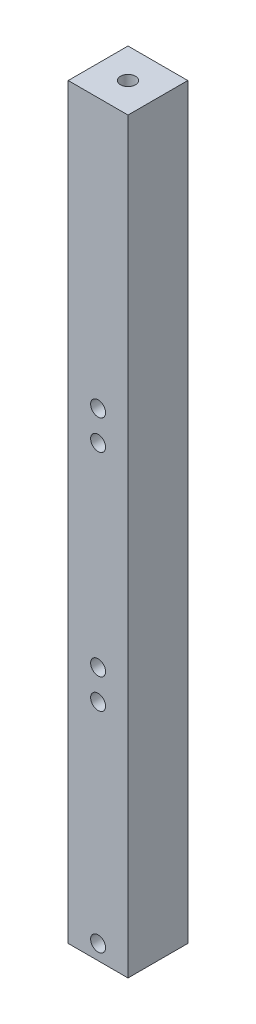
from build123d import *

# Parameters (mm, degrees)
SKETCH2_W           = 20
SKETCH2_H           = 20
SKETCH2_R           = 2.5
BOSS_EXTRUDE1_DEPTH = 250
SKETCH3_R           = 2.5
CUT_EXTRUDE1_DEPTH  = 251.99800796
SKETCH4_R           = 2.5
CUT_EXTRUDE2_DEPTH  = 251.99800796


with BuildPart() as part:
    # Sketch2 → Boss-Extrude1 (new body)
    with BuildSketch(Plane(origin=(0, 0, 0), x_dir=(1, 0, 0), z_dir=(0, 1, 0))):
        Rectangle(SKETCH2_W, SKETCH2_H)
        with Locations(Location((0, 0, 0), (0, 0, 270))):
            Circle(SKETCH2_R, mode=Mode.SUBTRACT)
    extrude(amount=BOSS_EXTRUDE1_DEPTH)

    # Sketch3 → Cut-Extrude1 (cut, through all)
    with BuildSketch(Plane.XY.offset(10)):
        with Locations((0, 5)):
            Circle(SKETCH3_R)
    extrude(amount=-CUT_EXTRUDE1_DEPTH, mode=Mode.SUBTRACT)

    # Sketch4 → Cut-Extrude2 (cut, through all)
    with BuildSketch(Plane.XY.offset(10)):
        with Locations((0, 75)):
            Circle(SKETCH4_R)
        with Locations((0, 85)):
            Circle(SKETCH4_R)
        with Locations((0, 150)):
            Circle(SKETCH4_R)
        with Locations((0, 160)):
            Circle(SKETCH4_R)
    extrude(amount=-CUT_EXTRUDE2_DEPTH, mode=Mode.SUBTRACT)


solid = part.part
